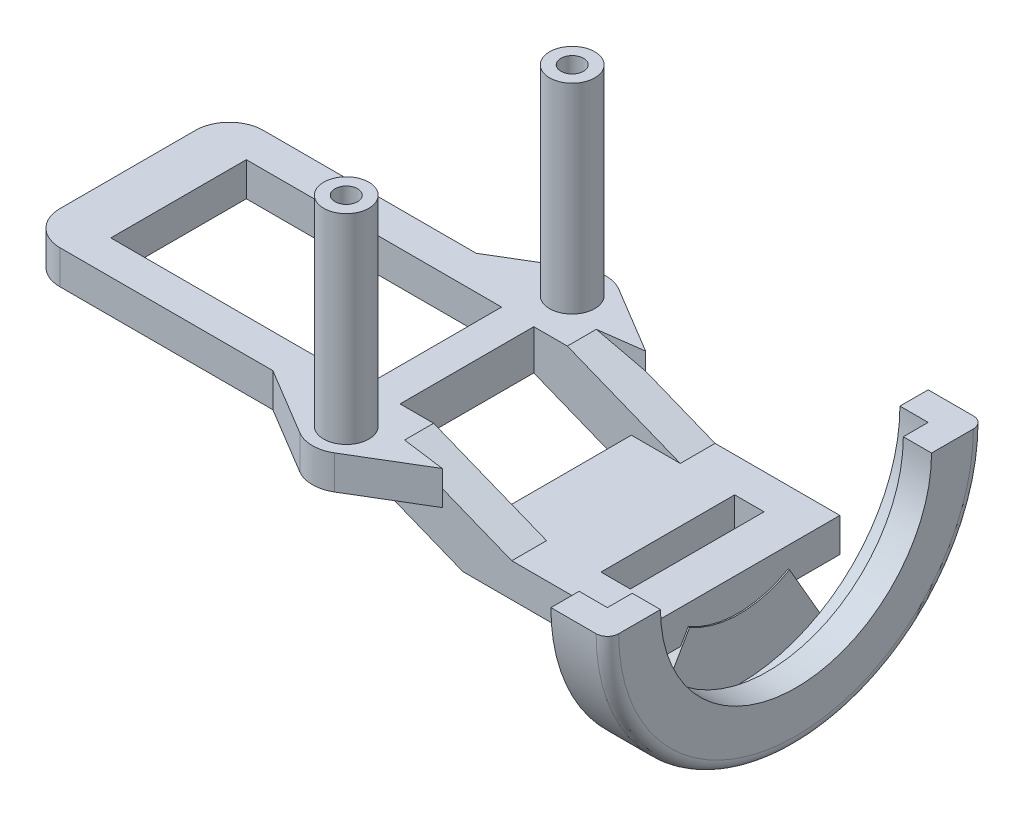
from build123d import *

# Parameters (mm, degrees)
SKETCH1_W                   = 22.6
SKETCH1_H                   = 12
BOSS_EXTRUDE1_DEPTH         = 3
BOSS_EXTRU_2_DEPTH          = 3
BOSS_EXTRU_1_REACH          = 45.022
ESQUISSE3_W                 = 8.636214684
ESQUISSE3_H                 = 11.84
ESQUISSE3_W_2               = 2.6
ENL_V_MAT_EXTRU_1_DEPTH     = 59.77153097
ESQUISSE6_R                 = 2
BOSS_EXTRU_3_DEPTH          = 17.7
ESQUISSE7_R                 = 1
ENL_V_MAT_EXTRU_3_DEPTH     = 4
R_VOLUTION1_ANGLE           = 90
R_VOLUTION1_OTHER_WAY_ANGLE = 90
REVOLVE1_ANGLE              = 30
REVOLVE1_OTHER_WAY_ANGLE    = 30
CONG_1_R                    = 3
CONG_2_R                    = 1
SKETCH3_W                   = 12.969079214
SKETCH3_H                   = 8.353445093
CUT_EXTRUDE1_DEPTH          = 11.84


with BuildPart() as part:
    # Sketch1 → Boss-Extrude1 (new body)
    with BuildSketch(Plane(origin=(0, 0, 0), x_dir=(1, 0, 0), z_dir=(0, 1, 0))):
        Polygon((33, 3), (33, 0), (0, 0), (0, 18), (33, 18), (33, 15), (31.6, 15), (31.6, 3), align=None)
        with Locations((15.8, 9)):
            Rectangle(SKETCH1_W, SKETCH1_H, mode=Mode.SUBTRACT)
    extrude(amount=BOSS_EXTRUDE1_DEPTH)

    # Esquisse4 → Boss.-Extru.2 (add)
    with BuildSketch(Plane.XZ):
        with BuildLine():
            Line((29.35, -17), (36.85, -18))
            Line((36.85, -18), (30.893033467, -21.572751002))
            ThreePointArc((30.893033467, -21.572751002), (29.35, -22), (27.806966533, -21.572751002))
            Line((27.806966533, -21.572751002), (21.85, -18))
            Line((21.85, -18), (29.35, -17))
        make_face()
        with BuildLine():
            Line((36.85, 0), (30.893033467, 3.572751002))
            ThreePointArc((30.893033467, 3.572751002), (29.35, 4), (27.806966533, 3.572751002))
            Line((27.806966533, 3.572751002), (21.85, 0))
            Line((21.85, 0), (29.35, -1))
            Line((29.35, -1), (36.85, 0))
        make_face()
    extrude(amount=-BOSS_EXTRU_2_DEPTH)

    # Boss.-Extru.1: up to this face of the body (flat: up to its plane)
    boss_extru_1_end = Plane(part.part.faces().sort_by_distance((10.925, 1.5, -18))[0])
    # Esquisse1 → Boss.-Extru.1 (add, up to the picked face)
    with BuildSketch(Plane.XY, mode=Mode.PRIVATE) as boss_extru_1_sk1:
        Polygon((43, -1), (33, 3), (28.66713547, 3), (28.66713547, 0), (38.66713547, -4), (54.04713547, -4), (54.04713547, -1), align=None)
    boss_extru_1_tool1 = split(extrude(boss_extru_1_sk1.sketch, amount=-BOSS_EXTRU_1_REACH, mode=Mode.PRIVATE), bisect_by=boss_extru_1_end, keep=Keep.BOTH, mode=Mode.PRIVATE)
    add(boss_extru_1_tool1.solids().sort_by(Axis((40.332957, -1.209124, 0), (0, 0, -1)))[0])

    # Esquisse3 → Enlèv. mat.-Extru.1 (cut, through all)
    with BuildSketch(Plane.XZ.offset(4)):
        with Locations((34.349028128, -9)):
            Rectangle(ESQUISSE3_W, ESQUISSE3_H)
        with Locations((49.115, -9)):
            Rectangle(ESQUISSE3_W_2, ESQUISSE3_H)
    extrude(amount=-ENL_V_MAT_EXTRU_1_DEPTH, mode=Mode.SUBTRACT)

    # Esquisse6 → Boss.-Extru.3 (add)
    with BuildSketch(Plane(origin=(0, 3, 0), x_dir=(1, 0, 0), z_dir=(0, 1, 0))):
        with Locations(Location((29.35, -1, 0), (0, 0, 90))):
            Circle(ESQUISSE6_R)
        with Locations(Location((29.35, 19, 0), (0, 0, 270))):
            Circle(ESQUISSE6_R)
    extrude(amount=BOSS_EXTRU_3_DEPTH)

    # Esquisse7 → Enlèv. mat.-Extru.3 (cut)
    with BuildSketch(Plane(origin=(0, 20.7, 0), x_dir=(1, 0, 0), z_dir=(0, 1, 0))):
        with Locations(Location((29.35, 19, 0), (0, 0, 270))):
            Circle(ESQUISSE7_R)
        with Locations(Location((29.35, -1, 0), (0, 0, 270))):
            Circle(ESQUISSE7_R)
    extrude(amount=-ENL_V_MAT_EXTRU_3_DEPTH, mode=Mode.SUBTRACT)



with BuildPart() as body_2:
    # Esquisse8 → Révolution1 (revolve)
    with BuildSketch(Plane.XY.offset(-9)):
        Polygon((56.665, -9.36), (54.165, -9.36), (54.165, -11.86), (59.165, -11.86), (59.165, -7.16), (56.665, -7.16), align=None)
    revolve(axis=Axis((74.438744763, 4.84, -9), (1, 0, 0)), revolution_arc=R_VOLUTION1_ANGLE)

    # Esquisse8 → Révolution1 other way (revolve)
    with BuildSketch(Plane.XY.offset(-9)):
        Polygon((56.665, -9.36), (54.165, -9.36), (54.165, -11.86), (59.165, -11.86), (59.165, -7.16), (56.665, -7.16), align=None)
    revolve(axis=Axis((74.438744763, 4.84, -9), (-1, 0, 0)), revolution_arc=R_VOLUTION1_OTHER_WAY_ANGLE)


with BuildPart() as part_1:
    add(part.part)

    add(body_2.part)  # Revolve1 merges body 2
    # Esquisse8<5> → Revolve1 (revolve)
    with BuildSketch(Plane.XY.offset(-9)):
        Polygon((54.165, -11.86), (54.165, -9.36), (54.165, -4), (51.665, -4), (51.665, -11.86), align=None)
    revolve(axis=Axis((74.438744763, 4.84, -9), (1, 0, 0)), revolution_arc=REVOLVE1_ANGLE)

    # Esquisse8<5> → Revolve1 other way (revolve)
    with BuildSketch(Plane.XY.offset(-9)):
        Polygon((54.165, -11.86), (54.165, -9.36), (54.165, -4), (51.665, -4), (51.665, -11.86), align=None)
    revolve(axis=Axis((74.438744763, 4.84, -9), (-1, 0, 0)), revolution_arc=REVOLVE1_OTHER_WAY_ANGLE)

    # Congé1
    cong_1_edges = [part_1.edges().sort_by_distance(p)[0] for p in [
        (0, 1.5, -18),
        (0, 1.5, 0),
    ]]
    fillet(cong_1_edges, radius=CONG_1_R)

    # Congé2
    cong_2_edges = [part_1.edges().sort_by_distance(p)[0] for p in [
        (59.165, -11.86, -9),
    ]]
    fillet(cong_2_edges, radius=CONG_2_R)

    # Sketch3 → Cut-Extrude1 (cut)
    with BuildSketch(Plane.XY.offset(-14.92)):
        with Locations((36.515460393, 3.176722547)):
            Rectangle(SKETCH3_W, SKETCH3_H)
    extrude(amount=CUT_EXTRUDE1_DEPTH, mode=Mode.SUBTRACT)


solid = part_1.part
